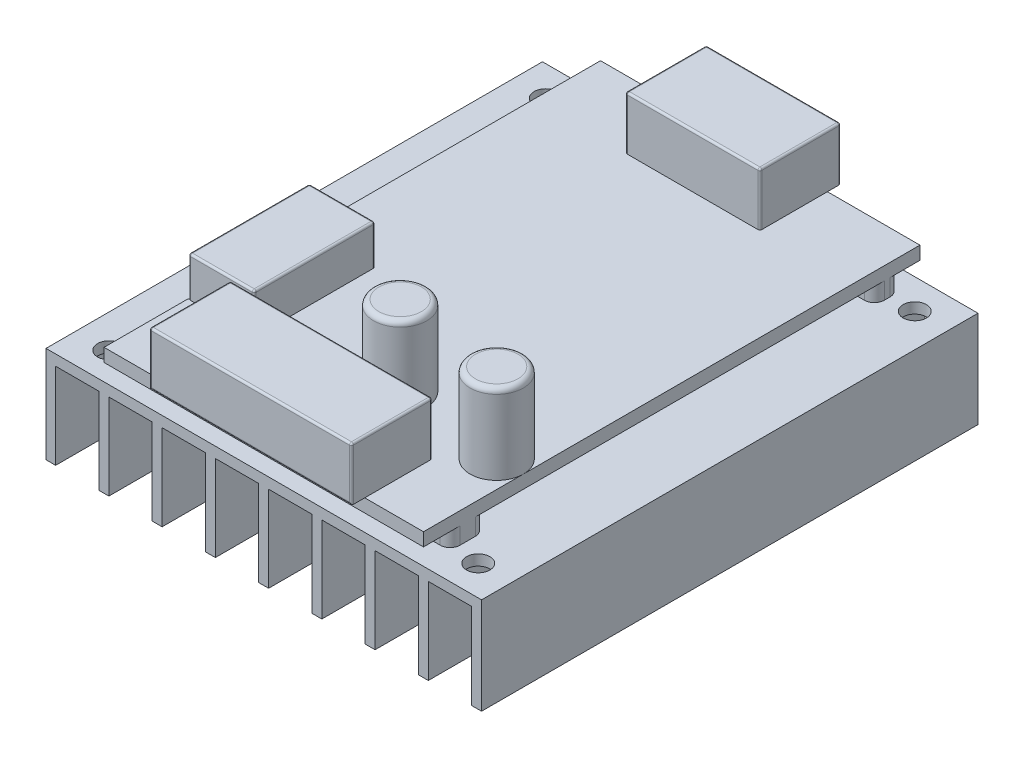
from build123d import *

# Parameters (mm, degrees)
ESBO_O2_W                = 65.45
ESBO_O2_H                = 74.6
ESBO_O2_R                = 1.75
RESSALTO_EXTRUS_O1_DEPTH = 14.5
CORTE_EXTRUS_O1_REACH    = 84.743
ESBO_O3_W                = 6.5
ESBO_O3_H                = 12.9
ESBO_O4_W                = 48
ESBO_O4_H                = 74.6
RESSALTO_EXTRUS_O2_DEPTH = 4.5
ESBO_O5_W                = 20.2
ESBO_O5_H                = 12.15
ESBO_O5_W_2              = 30.35
RESSALTO_EXTRUS_O3_DEPTH = 8
ESBO_O6_R                = 4
RESSALTO_EXTRUS_O4_DEPTH = 12
FILETE1_R                = 0.8
CORTE_EXTRUS_O2_REACH    = 86.916
ESBO_O7_W                = 40.368182155
ESBO_O7_H                = 2.522042385
ESBO_O8_W                = 58.468294986
ESBO_O8_H                = 2.522042385
CORTE_EXTRUS_O3_DEPTH    = 71.953968353
ESBO_O9_W                = 3.722226521
ESBO_O9_H                = 2.522042385
ESBO_O9_W_2              = 3.909591324
CORTE_EXTRUS_O4_DEPTH    = 4
ESBO_O10_W               = 3.909591324
ESBO_O10_H               = 2.522042385
ESBO_O10_W_2             = 3.722226521
CORTE_EXTRUS_O5_DEPTH    = 3
FILETE2_R                = 1.5
FILETE3_R                = 0.3
ESBO_O11_W               = 9.960941138
ESBO_O11_H               = 18.14579458
RESSALTO_EXTRUS_O5_DEPTH = 6
ESBO_O12_W               = 18.14579458
ESBO_O12_H               = 6.154854005
CORTE_EXTRUS_O6_DEPTH    = 0.1
FILETE4_R                = 0.3


with BuildPart() as part:
    # Esboço2 → Ressalto-extrusão1 (new body)
    with BuildSketch(Plane(origin=(0, 0, 0), x_dir=(1, 0, 0), z_dir=(0, 1, 0))):
        Rectangle(ESBO_O2_W, ESBO_O2_H)
        with Locations(Location((27.725, 32.8, 0), (0, 0, 270))):
            Circle(ESBO_O2_R, mode=Mode.SUBTRACT)
        with Locations(Location((-27.725, 32.8, 0), (0, 0, 270))):
            Circle(ESBO_O2_R, mode=Mode.SUBTRACT)
        with Locations(Location((27.725, -32.8, 0), (0, 0, 270))):
            Circle(ESBO_O2_R, mode=Mode.SUBTRACT)
        with Locations(Location((-27.725, -32.8, 0), (0, 0, 270))):
            Circle(ESBO_O2_R, mode=Mode.SUBTRACT)
    extrude(amount=-RESSALTO_EXTRUS_O1_DEPTH)

    # Esboço3 → Corte-extrusão1 (cut, up to next)
    with BuildSketch(Plane(origin=(0, 0, -37.3), x_dir=(-1, 0, 0), z_dir=(0, 0, -1)), mode=Mode.PRIVATE) as corte_extrus_o1_sk1:
        with Locations((-27.975, -8.05)):
            Rectangle(ESBO_O3_W, ESBO_O3_H)
    corte_extrus_o1_tool1 = extrude(corte_extrus_o1_sk1.sketch, amount=-CORTE_EXTRUS_O1_REACH, mode=Mode.PRIVATE) & part.part
    # Esboço3 → Corte-extrusão1 (cut, up to next)
    with BuildSketch(Plane(origin=(0, 0, -37.3), x_dir=(-1, 0, 0), z_dir=(0, 0, -1)), mode=Mode.PRIVATE) as corte_extrus_o1_sk2:
        with Locations((-19.975, -8.05)):
            Rectangle(ESBO_O3_W, ESBO_O3_H)
    corte_extrus_o1_tool2 = extrude(corte_extrus_o1_sk2.sketch, amount=-CORTE_EXTRUS_O1_REACH, mode=Mode.PRIVATE) & part.part
    # Esboço3 → Corte-extrusão1 (cut, up to next)
    with BuildSketch(Plane(origin=(0, 0, -37.3), x_dir=(-1, 0, 0), z_dir=(0, 0, -1)), mode=Mode.PRIVATE) as corte_extrus_o1_sk3:
        with Locations((-11.975, -8.05)):
            Rectangle(ESBO_O3_W, ESBO_O3_H)
    corte_extrus_o1_tool3 = extrude(corte_extrus_o1_sk3.sketch, amount=-CORTE_EXTRUS_O1_REACH, mode=Mode.PRIVATE) & part.part
    # Esboço3 → Corte-extrusão1 (cut, up to next)
    with BuildSketch(Plane(origin=(0, 0, -37.3), x_dir=(-1, 0, 0), z_dir=(0, 0, -1)), mode=Mode.PRIVATE) as corte_extrus_o1_sk4:
        with Locations((-3.975, -8.05)):
            Rectangle(ESBO_O3_W, ESBO_O3_H)
    corte_extrus_o1_tool4 = extrude(corte_extrus_o1_sk4.sketch, amount=-CORTE_EXTRUS_O1_REACH, mode=Mode.PRIVATE) & part.part
    # Esboço3 → Corte-extrusão1 (cut, up to next)
    with BuildSketch(Plane(origin=(0, 0, -37.3), x_dir=(-1, 0, 0), z_dir=(0, 0, -1)), mode=Mode.PRIVATE) as corte_extrus_o1_sk5:
        with Locations((4.025, -8.05)):
            Rectangle(ESBO_O3_W, ESBO_O3_H)
    corte_extrus_o1_tool5 = extrude(corte_extrus_o1_sk5.sketch, amount=-CORTE_EXTRUS_O1_REACH, mode=Mode.PRIVATE) & part.part
    # Esboço3 → Corte-extrusão1 (cut, up to next)
    with BuildSketch(Plane(origin=(0, 0, -37.3), x_dir=(-1, 0, 0), z_dir=(0, 0, -1)), mode=Mode.PRIVATE) as corte_extrus_o1_sk6:
        with Locations((12.025, -8.05)):
            Rectangle(ESBO_O3_W, ESBO_O3_H)
    corte_extrus_o1_tool6 = extrude(corte_extrus_o1_sk6.sketch, amount=-CORTE_EXTRUS_O1_REACH, mode=Mode.PRIVATE) & part.part
    # Esboço3 → Corte-extrusão1 (cut, up to next)
    with BuildSketch(Plane(origin=(0, 0, -37.3), x_dir=(-1, 0, 0), z_dir=(0, 0, -1)), mode=Mode.PRIVATE) as corte_extrus_o1_sk7:
        with Locations((20.025, -8.05)):
            Rectangle(ESBO_O3_W, ESBO_O3_H)
    corte_extrus_o1_tool7 = extrude(corte_extrus_o1_sk7.sketch, amount=-CORTE_EXTRUS_O1_REACH, mode=Mode.PRIVATE) & part.part
    # Esboço3 → Corte-extrusão1 (cut, up to next)
    with BuildSketch(Plane(origin=(0, 0, -37.3), x_dir=(-1, 0, 0), z_dir=(0, 0, -1)), mode=Mode.PRIVATE) as corte_extrus_o1_sk8:
        with Locations((28.025, -8.05)):
            Rectangle(ESBO_O3_W, ESBO_O3_H)
    corte_extrus_o1_tool8 = extrude(corte_extrus_o1_sk8.sketch, amount=-CORTE_EXTRUS_O1_REACH, mode=Mode.PRIVATE) & part.part
    add(corte_extrus_o1_tool1.solids().sort_by_distance((27.975, -8.05, -37.3))[0], mode=Mode.SUBTRACT)
    add(corte_extrus_o1_tool2.solids().sort_by_distance((19.975, -8.05, -37.3))[0], mode=Mode.SUBTRACT)
    add(corte_extrus_o1_tool3.solids().sort_by_distance((11.975, -8.05, -37.3))[0], mode=Mode.SUBTRACT)
    add(corte_extrus_o1_tool4.solids().sort_by_distance((3.975, -8.05, -37.3))[0], mode=Mode.SUBTRACT)
    add(corte_extrus_o1_tool5.solids().sort_by_distance((-4.025, -8.05, -37.3))[0], mode=Mode.SUBTRACT)
    add(corte_extrus_o1_tool6.solids().sort_by_distance((-12.025, -8.05, -37.3))[0], mode=Mode.SUBTRACT)
    add(corte_extrus_o1_tool7.solids().sort_by_distance((-20.025, -8.05, -37.3))[0], mode=Mode.SUBTRACT)
    add(corte_extrus_o1_tool8.solids().sort_by_distance((-28.025, -8.05, -37.3))[0], mode=Mode.SUBTRACT)

    # Esboço4 → Ressalto-extrusão2 (add)
    with BuildSketch(Plane(origin=(0, 0, 0), x_dir=(1, 0, 0), z_dir=(0, 1, 0))):
        Rectangle(ESBO_O4_W, ESBO_O4_H)
    extrude(amount=RESSALTO_EXTRUS_O2_DEPTH)

    # Esboço5 → Ressalto-extrusão3 (add)
    with BuildSketch(Plane(origin=(0, 4.5, 0), x_dir=(1, 0, 0), z_dir=(0, 1, 0))):
        with Locations((0, 33.225)):
            Rectangle(ESBO_O5_W, ESBO_O5_H)
        with Locations((0, -33.225)):
            Rectangle(ESBO_O5_W_2, ESBO_O5_H)
    extrude(amount=RESSALTO_EXTRUS_O3_DEPTH)

    # Esboço6 → Ressalto-extrusão4 (add)
    with BuildSketch(Plane(origin=(0, 4.5, 0), x_dir=(1, 0, 0), z_dir=(0, 1, 0))):
        with Locations((20, -22.3)):
            Circle(ESBO_O6_R)
        with Locations(Location((4, -20.8, 0), (0, 0, 270))):
            Circle(ESBO_O6_R)
    extrude(amount=RESSALTO_EXTRUS_O4_DEPTH)

    # Filete1
    filete1_edges = [part.edges().sort_by_distance(p)[0] for p in [
        (16, 16.5, 22.3),
        (4, 16.5, 16.8),
    ]]
    fillet(filete1_edges, radius=FILETE1_R)

    # Esboço7 → Corte-extrusão2 (cut, up to next)
    with BuildSketch(Plane(origin=(0, 0, -37.3), x_dir=(-1, 0, 0), z_dir=(0, 0, -1)), mode=Mode.PRIVATE) as corte_extrus_o2_sk1:
        with Locations((0.093682401, 1.261021193)):
            Rectangle(ESBO_O7_W, ESBO_O7_H)
    corte_extrus_o2_tool1 = extrude(corte_extrus_o2_sk1.sketch, amount=-CORTE_EXTRUS_O2_REACH, mode=Mode.PRIVATE) & part.part
    add(corte_extrus_o2_tool1.solids().sort_by_distance((-0.093682, 1.261021, -37.3))[0], mode=Mode.SUBTRACT)

    # Esboço8 → Corte-extrusão3 (cut, through all)
    with BuildSketch(Plane.ZY.offset(24)):
        with Locations((-1.218876055, 1.261021193)):
            Rectangle(ESBO_O8_W, ESBO_O8_H)
    extrude(amount=-CORTE_EXTRUS_O3_DEPTH, mode=Mode.SUBTRACT)

    # Esboço9 → Corte-extrusão4 (cut)
    with BuildSketch(Plane.XY.offset(37.3)):
        with Locations((-22.13888674, 1.261021193)):
            Rectangle(ESBO_O9_W, ESBO_O9_H)
        with Locations((22.045204338, 1.261021193)):
            Rectangle(ESBO_O9_W_2, ESBO_O9_H)
    extrude(amount=-CORTE_EXTRUS_O4_DEPTH, mode=Mode.SUBTRACT)

    # Esboço10 → Corte-extrusão5 (cut)
    with BuildSketch(Plane(origin=(0, 0, -37.3), x_dir=(-1, 0, 0), z_dir=(0, 0, -1))):
        with Locations((-22.045204338, 1.261021193)):
            Rectangle(ESBO_O10_W, ESBO_O10_H)
        with Locations((22.13888674, 1.261021193)):
            Rectangle(ESBO_O10_W_2, ESBO_O10_H)
    extrude(amount=-CORTE_EXTRUS_O5_DEPTH, mode=Mode.SUBTRACT)

    # Filete2
    filete2_edges = [part.edges().sort_by_distance(p)[0] for p in [
        (24, 1.261021193, -30.453023548),
        (20.090408676, 1.261021193, -30.453023548),
        (-20.277773479, 1.261021193, -30.453023548),
        (24, 1.261021193, 28.015271438),
        (20.090408676, 1.261021193, 28.015271438),
        (-20.277773479, 1.261021193, 28.015271438),
        (-24, 1.261021193, -30.453023548),
        (-24, 1.261021193, 28.015271438),
        (-20.277773479, 1.261021193, 33.3),
        (-24, 1.261021193, 33.3),
        (20.090408676, 1.261021193, 33.3),
        (24, 1.261021193, 33.3),
        (20.090408676, 1.261021193, -34.3),
        (24, 1.261021193, -34.3),
        (-20.277773479, 1.261021193, -34.3),
        (-24, 1.261021193, -34.3),
    ]]
    fillet(filete2_edges, radius=FILETE2_R)

    # Filete3
    filete3_edges = [part.edges().sort_by_distance(p)[0] for p in [
        (-10.1, 8.5, -39.3),
        (-10.1, 8.5, -27.15),
        (10.1, 8.5, -27.15),
        (0, 4.5, -39.3),
        (10.1, 8.5, -39.3),
        (-10.1, 12.5, -33.225),
        (0, 12.5, -27.15),
        (10.1, 12.5, -33.225),
        (0, 12.5, -39.3),
        (15.175, 8.5, 39.3),
        (15.175, 8.5, 27.15),
        (-15.175, 8.5, 27.15),
        (0, 4.5, 39.3),
        (-15.175, 8.5, 39.3),
        (15.175, 12.5, 33.225),
        (0, 12.5, 27.15),
        (-15.175, 12.5, 33.225),
        (0, 12.5, 39.3),
    ]]
    fillet(filete3_edges, radius=FILETE3_R)

    # Esboço11 → Ressalto-extrusão5 (add)
    with BuildSketch(Plane(origin=(0, 4.5, 0), x_dir=(1, 0, 0), z_dir=(0, 1, 0))):
        with Locations((-19.019529431, -15.624104827)):
            Rectangle(ESBO_O11_W, ESBO_O11_H)
    extrude(amount=RESSALTO_EXTRUS_O5_DEPTH)

    # Esboço12 → Corte-extrusão6 (cut)
    with BuildSketch(Plane.ZY.offset(24)):
        with Locations((15.624104827, 7.422572997)):
            Rectangle(ESBO_O12_W, ESBO_O12_H)
    extrude(amount=-CORTE_EXTRUS_O6_DEPTH, mode=Mode.SUBTRACT)

    # Filete4
    filete4_edges = [part.edges().sort_by_distance(p)[0] for p in [
        (-14.039058862, 7.5, 24.697002117),
        (-14.039058862, 7.5, 6.551207537),
        (-14.039058862, 10.5, 15.624104827),
        (-18.969529431, 10.5, 6.551207537),
        (-18.969529431, 10.5, 24.697002117),
        (-23.9, 7.5, 6.551207537),
        (-23.9, 7.5, 24.697002117),
        (-23.9, 10.5, 15.624104827),
    ]]
    fillet(filete4_edges, radius=FILETE4_R)


solid = part.part
